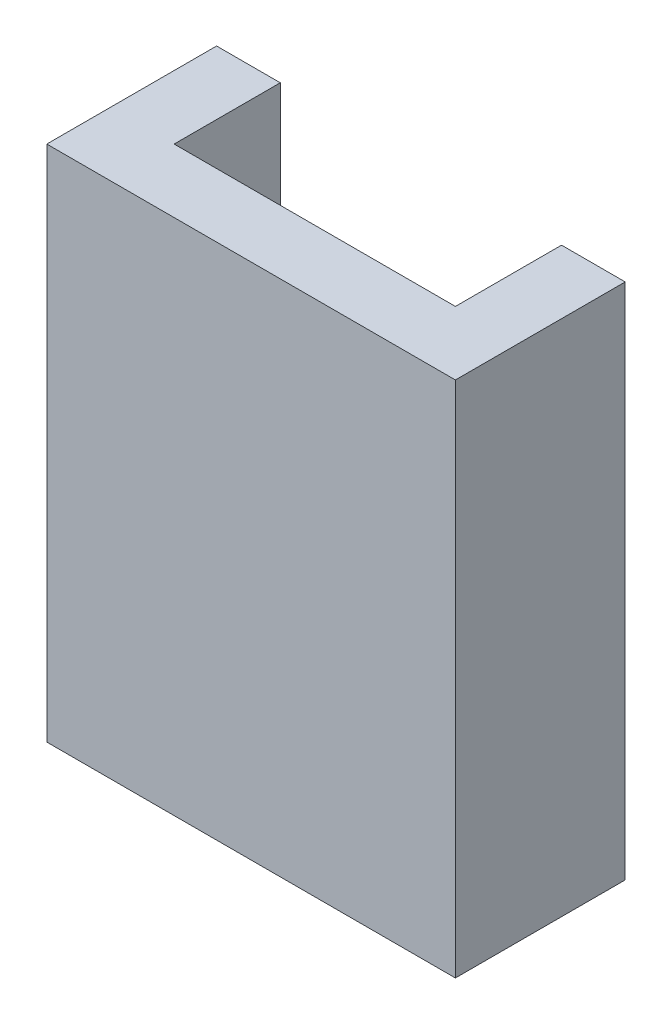
from build123d import *

# Parameters (mm, degrees)
BOSS_EXTRUDE1_DEPTH = 24.4


with BuildPart() as part:
    # Sketch2 → Boss-Extrude1 (new body)
    with BuildSketch(Plane(origin=(0, 0, 0), x_dir=(1, 0, 0), z_dir=(0, 1, 0))):
        Polygon((-6.625, 0), (-9.625, 0), (-9.625, -8), (9.625, -8), (9.625, 0), (6.625, 0), (6.625, -5), (-6.625, -5), align=None)
    extrude(amount=BOSS_EXTRUDE1_DEPTH)


solid = part.part
